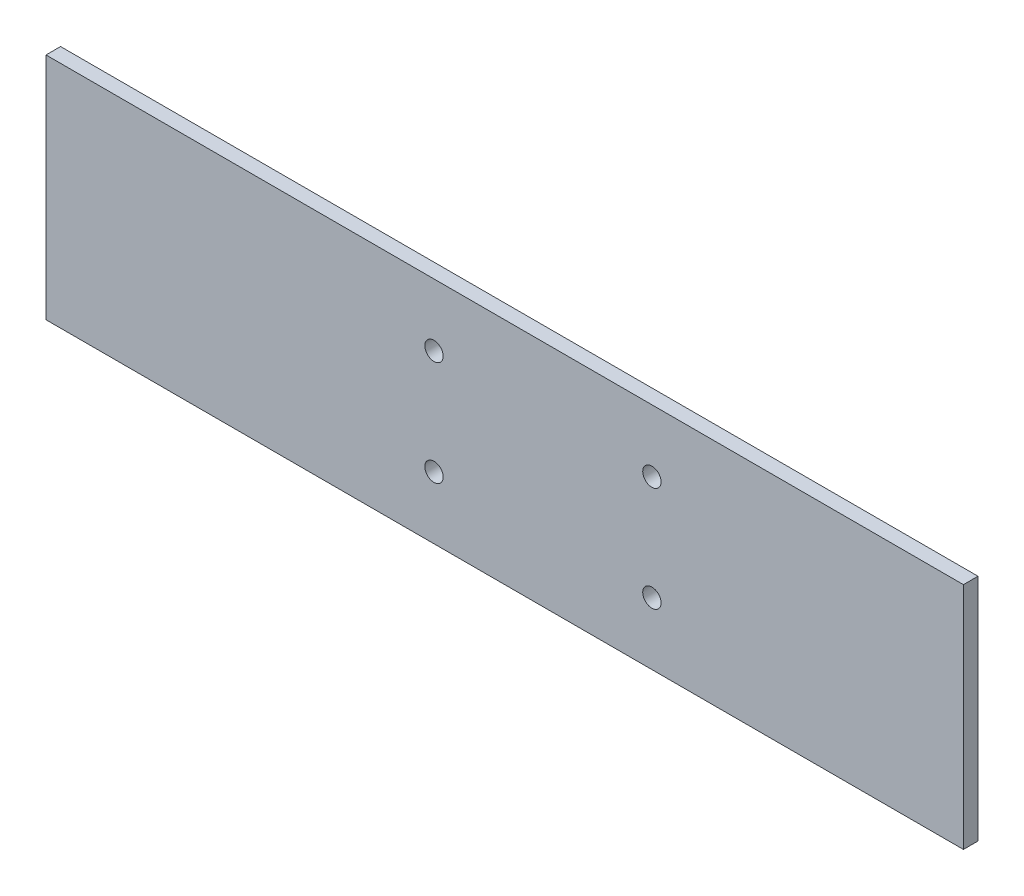
from build123d import *

# Parameters (mm, degrees)
SKETCH1_W           = 250
SKETCH1_H           = 150
SKETCH1_R           = 6
BOSS_EXTRUDE1_DEPTH = 9.525
SKETCH2_W           = 9.525
SKETCH2_H           = 150
BOSS_EXTRUDE2_DEPTH = 200
SKETCH3_W           = 9.525
SKETCH3_H           = 150
BOSS_EXTRUDE3_DEPTH = 150


with BuildPart() as part:
    # Sketch1 → Boss-Extrude1 (new body)
    with BuildSketch(Plane.XY):
        with Locations((125, -75)):
            Rectangle(SKETCH1_W, SKETCH1_H)
        with Locations(Location((53.75, -40.75, 0), (0, 0, 180))):
            Circle(SKETCH1_R, mode=Mode.SUBTRACT)
        with Locations(Location((196.25, -40.75, 0), (0, 0, 180))):
            Circle(SKETCH1_R, mode=Mode.SUBTRACT)
        with Locations(Location((196.25, -109.25, 0), (0, 0, 180))):
            Circle(SKETCH1_R, mode=Mode.SUBTRACT)
        with Locations(Location((53.75, -109.25, 0), (0, 0, 180))):
            Circle(SKETCH1_R, mode=Mode.SUBTRACT)
    extrude(amount=BOSS_EXTRUDE1_DEPTH)

    # Sketch2 → Boss-Extrude2 (add)
    with BuildSketch(Plane.ZY):
        with Locations((4.7625, -75)):
            Rectangle(SKETCH2_W, SKETCH2_H)
    extrude(amount=BOSS_EXTRUDE2_DEPTH)

    # Sketch3 → Boss-Extrude3 (add)
    with BuildSketch(Plane(origin=(250, 0, 0), x_dir=(0, 0, -1), z_dir=(1, 0, 0))):
        with Locations((-4.7625, -75)):
            Rectangle(SKETCH3_W, SKETCH3_H)
    extrude(amount=BOSS_EXTRUDE3_DEPTH)


solid = part.part
